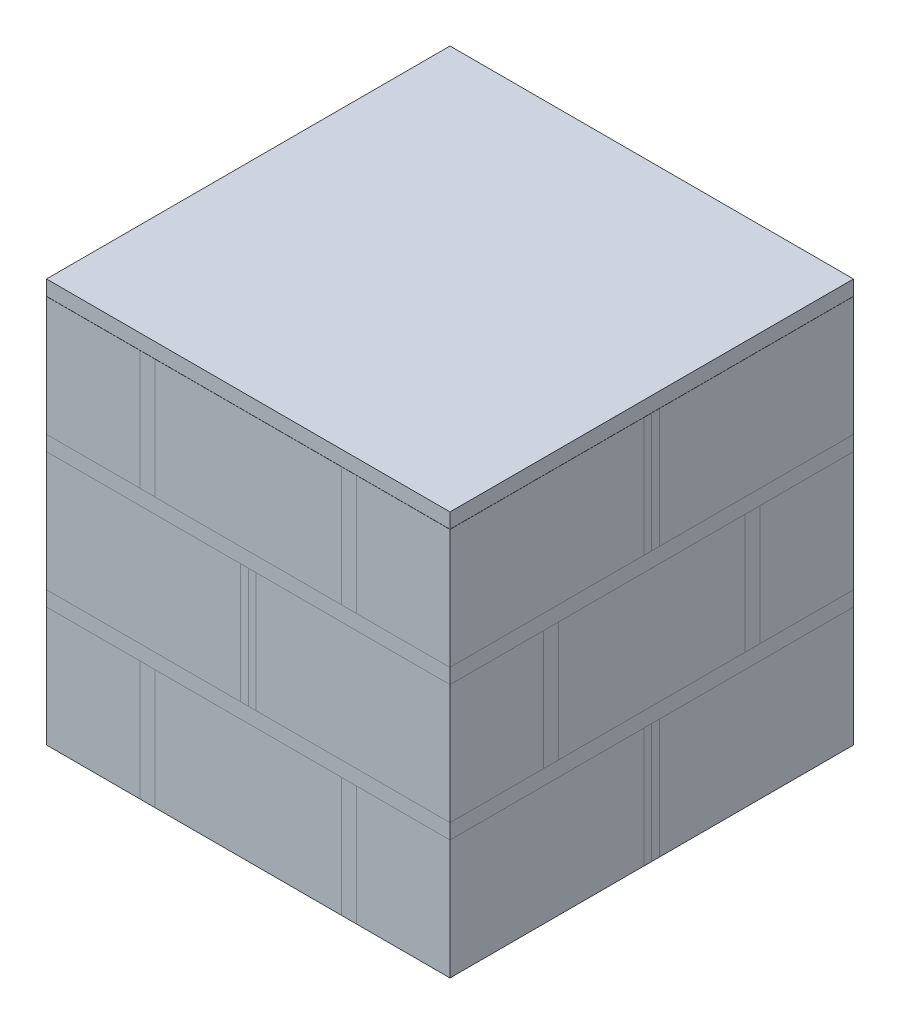
from build123d import *

# Parameters (mm, degrees)
SKETCH_3_W             = 6.215
SKETCH_3_H             = 12.935
EXTRUDE_2_DEPTH        = 7.96
SKETCH_3_W_2           = 12.44
EXTRUDE_2_2_DEPTH      = 7.96
EXTRUDE_2_3_DEPTH      = 7.96
EXTRUDE_3_DEPTH        = 7.96
SKETCH_4_W             = 26.87
SKETCH_4_H             = 26.87
EXTRUDE_4_DEPTH        = 1
SKETCH_6_W             = 12.935
SKETCH_6_H             = 6.215
EXTRUDE_5_DEPTH        = 7.96
SKETCH_6_H_2           = 12.44
EXTRUDE_5_2_DEPTH      = 7.96
EXTRUDE_5_3_DEPTH      = 7.96
EXTRUDE_6_DEPTH        = 7.96
PATTERN_LINEAR_2_COUNT = 3
PATTERN_LINEAR_2_PITCH = 8.96
PATTERN_LINEAR_3_COUNT = 2
PATTERN_LINEAR_3_PITCH = 17.91


with BuildPart() as part:
    # Эскиз3 → Бобышка-Вытянуть2 (new body)
    with BuildSketch(Plane(origin=(0, 0, 0), x_dir=(1, 0, 0), z_dir=(0, 1, 0))):
        with Locations((-10.3275, -6.9675)):
            Rectangle(SKETCH_3_W, SKETCH_3_H)
    extrude(amount=EXTRUDE_2_DEPTH)


with BuildPart() as body_2:
    # Эскиз3 → Extrude 2 2 (new body)
    with BuildSketch(Plane(origin=(0, 0, 0), x_dir=(1, 0, 0), z_dir=(0, 1, 0))):
        with Locations((0, -6.9675)):
            Rectangle(SKETCH_3_W_2, SKETCH_3_H)
    extrude(amount=EXTRUDE_2_2_DEPTH)


with BuildPart() as body_3:
    # Эскиз3 → Extrude 2 3 (new body)
    with BuildSketch(Plane(origin=(0, 0, 0), x_dir=(1, 0, 0), z_dir=(0, 1, 0))):
        with Locations((10.3275, -6.9675)):
            Rectangle(SKETCH_3_W, SKETCH_3_H)
    extrude(amount=EXTRUDE_2_3_DEPTH)


with BuildPart() as body_4:
    # Эскиз3<4> → Бобышка-Вытянуть3 (new body)
    with BuildSketch(Plane(origin=(0, 0, 0), x_dir=(1, 0, 0), z_dir=(0, 1, 0))):
        Polygon((-6.22, -0.5), (6.22, -0.5), (6.22, -13.435), (6.72, -13.435), (6.72, 0), (-6.72, 0), (-6.72, -13.435), (-6.22, -13.435), align=None)
        Polygon((6.72, 0), (6.72, -13.435), (7.22, -13.435), (7.22, -0.5), (13.435, -0.5), (13.435, 0), align=None)
        Polygon((-7.22, -13.435), (-6.72, -13.435), (-6.72, 0), (-13.435, 0), (-13.435, -0.5), (-7.22, -0.5), align=None)
    extrude(amount=EXTRUDE_3_DEPTH)


with BuildPart() as body_5:
    # Зеркальное отражение1: mirrored copy
    add(body_4.part.mirror(Plane.XY))


with BuildPart() as body_6:
    # Mirror 1 2: mirrored copy
    add(body_3.part.mirror(Plane.XY))


with BuildPart() as body_7:
    # Mirror 1 3: mirrored copy
    add(part.part.mirror(Plane.XY))


with BuildPart() as body_8:
    # Mirror 1 4: mirrored copy
    add(body_2.part.mirror(Plane.XY))


with BuildPart() as body_9:
    # Эскиз4 → Бобышка-Вытянуть4 (new body)
    with BuildSketch(Plane(origin=(0, 7.96, 0), x_dir=(1, 0, 0), z_dir=(0, 1, 0))):
        Rectangle(SKETCH_4_W, SKETCH_4_H)
    extrude_4 = extrude(amount=EXTRUDE_4_DEPTH)


with BuildPart() as body_10:
    # Эскиз6 → Бобышка-Вытянуть5 (new body)
    with BuildSketch(Plane(origin=(0, 8.96, 0), x_dir=(1, 0, 0), z_dir=(0, 1, 0))):
        with Locations((6.9675, -10.3275)):
            Rectangle(SKETCH_6_W, SKETCH_6_H)
    extrude(amount=EXTRUDE_5_DEPTH)


with BuildPart() as body_11:
    # Эскиз6 → Extrude 5 2 (new body)
    with BuildSketch(Plane(origin=(0, 8.96, 0), x_dir=(1, 0, 0), z_dir=(0, 1, 0))):
        with Locations((6.9675, 0)):
            Rectangle(SKETCH_6_W, SKETCH_6_H_2)
    extrude(amount=EXTRUDE_5_2_DEPTH)


with BuildPart() as body_12:
    # Эскиз6 → Extrude 5 3 (new body)
    with BuildSketch(Plane(origin=(0, 8.96, 0), x_dir=(1, 0, 0), z_dir=(0, 1, 0))):
        with Locations((6.9675, 10.3275)):
            Rectangle(SKETCH_6_W, SKETCH_6_H)
    extrude(amount=EXTRUDE_5_3_DEPTH)


with BuildPart() as body_13:
    # Эскиз6<6> → Бобышка-Вытянуть6 (new body)
    with BuildSketch(Plane(origin=(0, 8.96, 0), x_dir=(1, 0, 0), z_dir=(0, 1, 0))):
        Polygon((13.435, -7.22), (13.435, -6.72), (0, -6.72), (0, -13.435), (0.5, -13.435), (0.5, -7.22), align=None)
        Polygon((0.5, -6.22), (0.5, 6.22), (13.435, 6.22), (13.435, 6.72), (0, 6.72), (0, -6.72), (13.435, -6.72), (13.435, -6.22), align=None)
        Polygon((0, 6.72), (13.435, 6.72), (13.435, 7.22), (0.5, 7.22), (0.5, 13.435), (0, 13.435), align=None)
    extrude(amount=EXTRUDE_6_DEPTH)


with BuildPart() as body_14:
    # Зеркальное отражение2: mirrored copy
    add(body_10.part.mirror(Plane(origin=(0, 0, 0), x_dir=(0, 0, 1), z_dir=(1, 0, 0))))


with BuildPart() as body_15:
    # Mirror 2 2: mirrored copy
    add(body_11.part.mirror(Plane(origin=(0, 0, 0), x_dir=(0, 0, 1), z_dir=(1, 0, 0))))


with BuildPart() as body_16:
    # Mirror 2 3: mirrored copy
    add(body_12.part.mirror(Plane(origin=(0, 0, 0), x_dir=(0, 0, 1), z_dir=(1, 0, 0))))


with BuildPart() as body_17:
    # Mirror 2 4: mirrored copy
    add(body_13.part.mirror(Plane(origin=(0, 0, 0), x_dir=(0, 0, 1), z_dir=(1, 0, 0))))


with BuildPart() as pattern_linear_2_1:
    # Линейный массив2: Бобышка-Вытянуть4 ×3
    with Locations(*[(0, i * PATTERN_LINEAR_2_PITCH, 0) for i in range(1, PATTERN_LINEAR_2_COUNT)]):
        add(extrude_4)


with BuildPart() as pattern_linear_3_1:
    # Линейный массив3: pattern copy
    add(part.part.moved(Location(Vector(0, 1, 0) * (1 * PATTERN_LINEAR_3_PITCH))))


with BuildPart() as pattern_linear_3_2:
    # Линейный массив3: pattern copy
    add(body_2.part.moved(Location(Vector(0, 1, 0) * (1 * PATTERN_LINEAR_3_PITCH))))


with BuildPart() as pattern_linear_3_3:
    # Линейный массив3: pattern copy
    add(body_3.part.moved(Location(Vector(0, 1, 0) * (1 * PATTERN_LINEAR_3_PITCH))))


with BuildPart() as pattern_linear_3_4:
    # Линейный массив3: pattern copy
    add(body_6.part.moved(Location(Vector(0, 1, 0) * (1 * PATTERN_LINEAR_3_PITCH))))


with BuildPart() as pattern_linear_3_5:
    # Линейный массив3: pattern copy
    add(body_8.part.moved(Location(Vector(0, 1, 0) * (1 * PATTERN_LINEAR_3_PITCH))))


with BuildPart() as pattern_linear_3_6:
    # Линейный массив3: pattern copy
    add(body_7.part.moved(Location(Vector(0, 1, 0) * (1 * PATTERN_LINEAR_3_PITCH))))


with BuildPart() as pattern_linear_3_7:
    # Линейный массив3: pattern copy
    add(body_4.part.moved(Location(Vector(0, 1, 0) * (1 * PATTERN_LINEAR_3_PITCH))))


with BuildPart() as pattern_linear_3_8:
    # Линейный массив3: pattern copy
    add(body_5.part.moved(Location(Vector(0, 1, 0) * (1 * PATTERN_LINEAR_3_PITCH))))


solid = Compound([part.part, body_2.part, body_3.part, body_4.part, body_5.part, body_6.part, body_7.part, body_8.part, body_9.part, body_10.part, body_11.part, body_12.part, body_13.part, body_14.part, body_15.part, body_16.part, body_17.part, pattern_linear_2_1.part, pattern_linear_3_1.part, pattern_linear_3_2.part, pattern_linear_3_3.part, pattern_linear_3_4.part, pattern_linear_3_5.part, pattern_linear_3_6.part, pattern_linear_3_7.part, pattern_linear_3_8.part])
